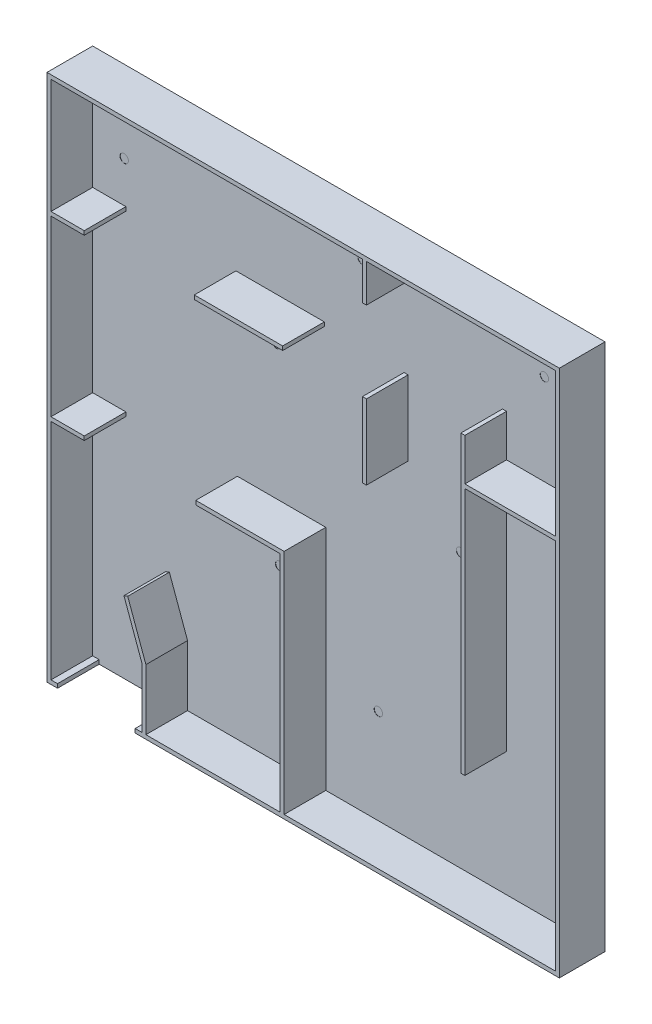
from build123d import *

# Parameters (mm, degrees)
ESQUISSE1_W             = 2435
ESQUISSE1_H             = 2510
ESQUISSE1_W_2           = 2397
ESQUISSE1_H_2           = 2472
EXTRU_MINCE1_DEPTH      = 198
ESQUISSE2_W             = 2435
ESQUISSE2_H             = 2510
BOSS_EXTRU_1_DEPTH      = 19
EXTRU_MINCE3_DEPTH      = 198
EXTRU_MINCE4_DEPTH      = 198
ESQUISSE6_W             = 158
ESQUISSE6_H             = 19
EXTRU_MINCE5_DEPTH      = 198
ESQUISSE7_W             = 158
ESQUISSE7_H             = 19
EXTRU_MINCE6_DEPTH      = 198
ESQUISSE8_W             = 369
ESQUISSE8_H             = 198
ENL_V_MAT_EXTRU_1_DEPTH = 19
ESQUISSE9_W             = 19
ESQUISSE9_H             = 180
EXTRU_MINCE7_DEPTH      = 198
ESQUISSE10_W            = 420
ESQUISSE10_H            = 19
EXTRU_MINCE8_DEPTH      = 198
ESQUISSE11_W            = 19
ESQUISSE11_H            = 355
EXTRU_MINCE9_DEPTH      = 198
EXTRU_MINCE10_DEPTH     = 198
ESQUISSE14_W            = 19
ESQUISSE14_H            = 200
EXTRU_MINCE11_DEPTH     = 198
ESQUISSE17_W            = 250
ESQUISSE17_H            = 56.028388795
BOSS_EXTRU_2_DEPTH      = 10
ESQUISSE18_R            = 20
ENL_V_MAT_EXTRU_2_DEPTH = 1


with BuildPart() as part:
    # Esquisse1 → Extru.-Mince1 (new body)
    with BuildSketch(Plane.XY):
        with Locations((1217.5, 1255)):
            Rectangle(ESQUISSE1_W, ESQUISSE1_H)
        with Locations((1217.5, 1255)):
            Rectangle(ESQUISSE1_W_2, ESQUISSE1_H_2, mode=Mode.SUBTRACT)
    extrude(amount=EXTRU_MINCE1_DEPTH)

    # Esquisse2 → Boss.-Extru.1 (add)
    with BuildSketch(Plane(origin=(0, 0, 0), x_dir=(-1, 0, 0), z_dir=(0, 0, -1))):
        with Locations((-1217.5, 1255)):
            Rectangle(ESQUISSE2_W, ESQUISSE2_H)
    extrude(amount=BOSS_EXTRU_1_DEPTH)

    # Esquisse4 → Extru.-Mince3 (add)
    with BuildSketch(Plane.XY):
        Polygon((451, 19), (451, 304), (365.706389454, 539), (383.566389454, 545.482314402), (470, 307.341399176), (470, 19), align=None)
    extrude(amount=EXTRU_MINCE3_DEPTH)

    # Esquisse5 → Extru.-Mince4 (add)
    with BuildSketch(Plane.XY):
        Polygon((707, 1102), (1127, 1102), (1127, 19), (1108, 19), (1108, 1083), (707, 1083), align=None)
    extrude(amount=EXTRU_MINCE4_DEPTH)

    # Esquisse6 → Extru.-Mince5 (add)
    with BuildSketch(Plane.XY):
        with Locations((98, 1937.5)):
            Rectangle(ESQUISSE6_W, ESQUISSE6_H)
    extrude(amount=EXTRU_MINCE5_DEPTH)

    # Esquisse7 → Extru.-Mince6 (add)
    with BuildSketch(Plane.XY):
        with Locations((98, 1092.5)):
            Rectangle(ESQUISSE7_W, ESQUISSE7_H)
    extrude(amount=EXTRU_MINCE6_DEPTH)

    # Esquisse8 → Enlèv. mat.-Extru.1 (cut)
    with BuildSketch(Plane.XZ):
        with Locations((234.5, 99)):
            Rectangle(ESQUISSE8_W, ESQUISSE8_H)
    extrude(amount=-ENL_V_MAT_EXTRU_1_DEPTH, mode=Mode.SUBTRACT)

    # Esquisse9 → Extru.-Mince7 (add)
    with BuildSketch(Plane.XY):
        with Locations((1508.5, 2401)):
            Rectangle(ESQUISSE9_W, ESQUISSE9_H)
    extrude(amount=EXTRU_MINCE7_DEPTH)

    # Esquisse10 → Extru.-Mince8 (add)
    with BuildSketch(Plane.XY):
        with Locations((910, 1934.5)):
            Rectangle(ESQUISSE10_W, ESQUISSE10_H)
    extrude(amount=EXTRU_MINCE8_DEPTH)

    # Esquisse11 → Extru.-Mince9 (add)
    with BuildSketch(Plane.XY):
        with Locations((1508.5, 1747.5)):
            Rectangle(ESQUISSE11_W, ESQUISSE11_H)
    extrude(amount=EXTRU_MINCE9_DEPTH)

    # Esquisse13 → Extru.-Mince10 (add)
    with BuildSketch(Plane.XY):
        Polygon((2416, 1809), (1967, 1809), (1967, 609), (1986, 609), (1986, 1790), (2416, 1790), align=None)
    extrude(amount=EXTRU_MINCE10_DEPTH)

    # Esquisse14 → Extru.-Mince11 (add)
    with BuildSketch(Plane.XY):
        with Locations((1976.5, 1909)):
            Rectangle(ESQUISSE14_W, ESQUISSE14_H)
    extrude(amount=EXTRU_MINCE11_DEPTH)

    # Esquisse17 → Boss.-Extru.2 (add)
    with BuildSketch(Plane.XY):
        with Locations((2181, 1761.985805603)):
            Rectangle(ESQUISSE17_W, ESQUISSE17_H)
    extrude(amount=BOSS_EXTRU_2_DEPTH)

    # Esquisse18 → Enlèv. mat.-Extru.2 (cut)
    with BuildSketch(Plane.XY):
        with Locations((2166, 2241)):
            Circle(ESQUISSE18_R)
        with Locations((169, 2141)):
            Circle(ESQUISSE18_R)
        with Locations((1377, 469)):
            Circle(ESQUISSE18_R)
        with Locations((1767, 1319)):
            Circle(ESQUISSE18_R)
        with Locations((894, 1741)):
            Circle(ESQUISSE18_R)
        with Locations((908, 833)):
            Circle(ESQUISSE18_R)
        with Locations((1299, 2291)):
            Circle(ESQUISSE18_R)
    extrude(amount=-ENL_V_MAT_EXTRU_2_DEPTH, mode=Mode.SUBTRACT)


solid = part.part
